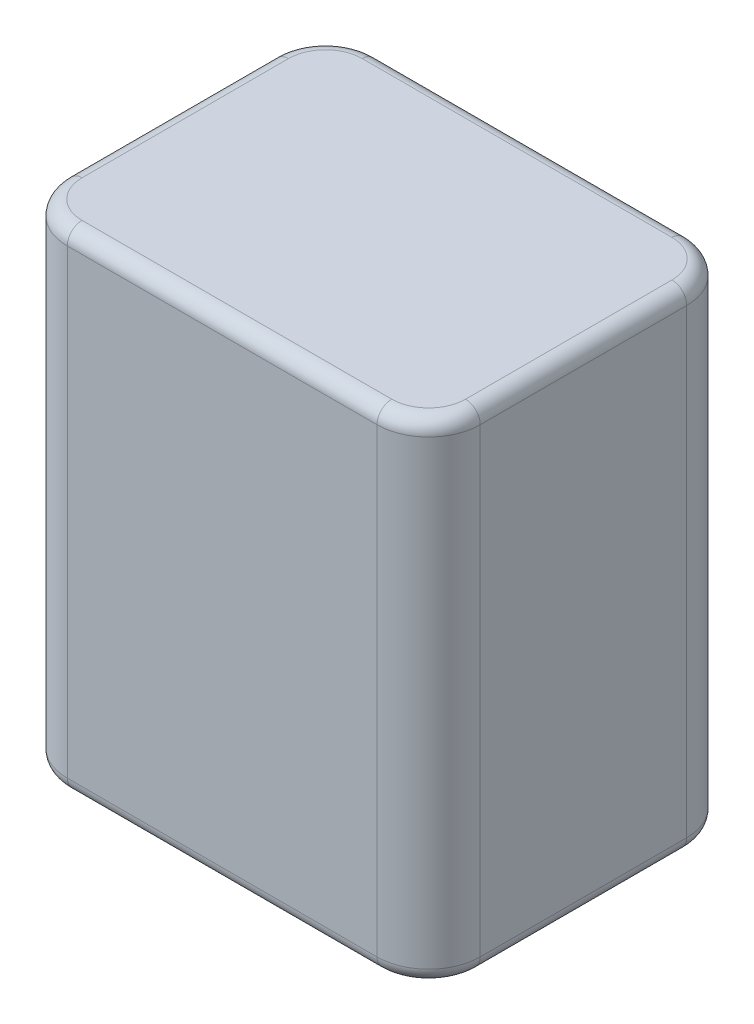
from build123d import *

# Parameters (mm, degrees)
BOSS_EXTRUDE1_DEPTH = 66.5
FILLET1_R           = 2


with BuildPart() as part:
    # Sketch1 → Boss-Extrude1 (new body)
    with BuildSketch(Plane(origin=(0, 0, 0), x_dir=(1, 0, 0), z_dir=(0, 1, 0))):
        with BuildLine():
            Line((-21, -21), (21, -21))
            ThreePointArc((21, -21), (25.949747468, -18.949747468), (28, -14))
            Line((28, -14), (28, 14))
            ThreePointArc((28, 14), (25.949747468, 18.949747468), (21, 21))
            Line((21, 21), (-21, 21))
            ThreePointArc((-21, 21), (-25.949747468, 18.949747468), (-28, 14))
            Line((-28, 14), (-28, -14))
            ThreePointArc((-28, -14), (-25.949747468, -18.949747468), (-21, -21))
        make_face()
    extrude(amount=BOSS_EXTRUDE1_DEPTH)

    # Fillet1
    fillet1_edges = [part.edges().sort_by_distance(p)[0] for p in [
        (28, 0, 0),
        (25.949747468, 0, 18.949747468),
        (0, 0, 21),
        (-25.949747468, 0, 18.949747468),
        (25.949747468, 66.5, 18.949747468),
        (28, 66.5, 0),
        (25.949747468, 66.5, -18.949747468),
        (0, 66.5, -21),
        (-25.949747468, 66.5, -18.949747468),
        (-28, 66.5, 0),
        (-25.949747468, 66.5, 18.949747468),
        (-28, 0, 0),
        (0, 66.5, 21),
        (-25.949747468, 0, -18.949747468),
        (0, 0, -21),
        (25.949747468, 0, -18.949747468),
    ]]
    fillet(fillet1_edges, radius=FILLET1_R)


solid = part.part
